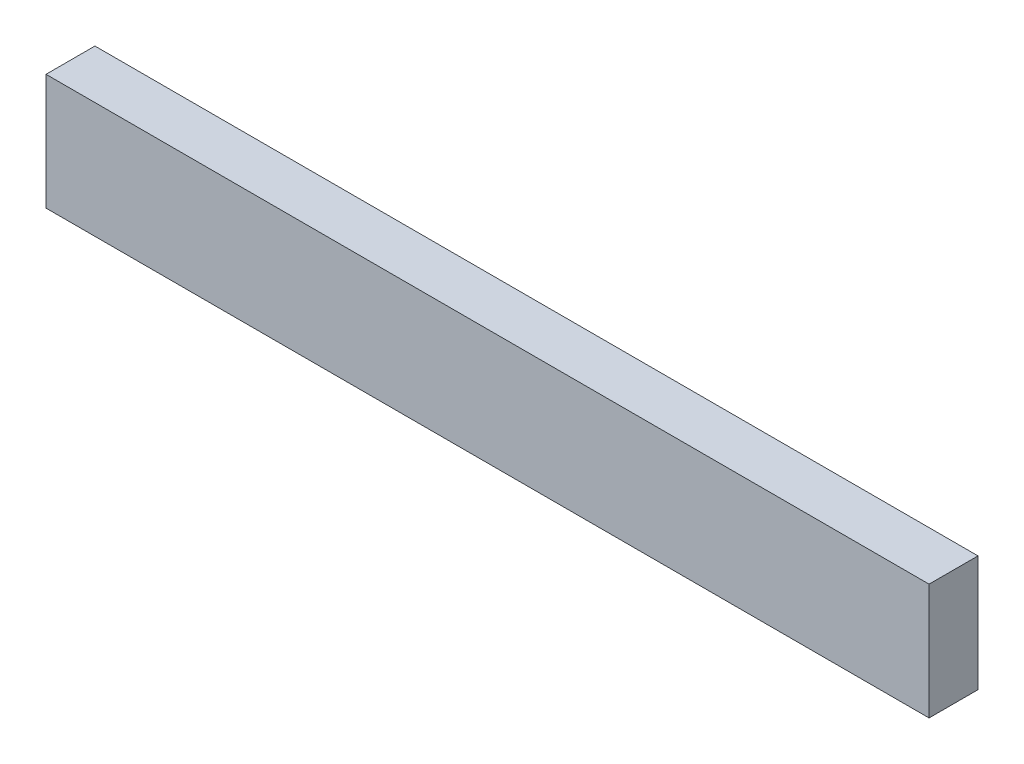
from build123d import *

# Parameters (mm, degrees)
SKETCH1_W           = 342.85
SKETCH1_H           = 19
BOSS_EXTRUDE1_DEPTH = 45


with BuildPart() as part:
    # Sketch1 → Boss-Extrude1 (new body)
    with BuildSketch(Plane(origin=(0, 0, 0), x_dir=(1, 0, 0), z_dir=(0, 1, 0))):
        with Locations((171.425, 0)):
            Rectangle(SKETCH1_W, SKETCH1_H)
    extrude(amount=BOSS_EXTRUDE1_DEPTH)


solid = part.part
